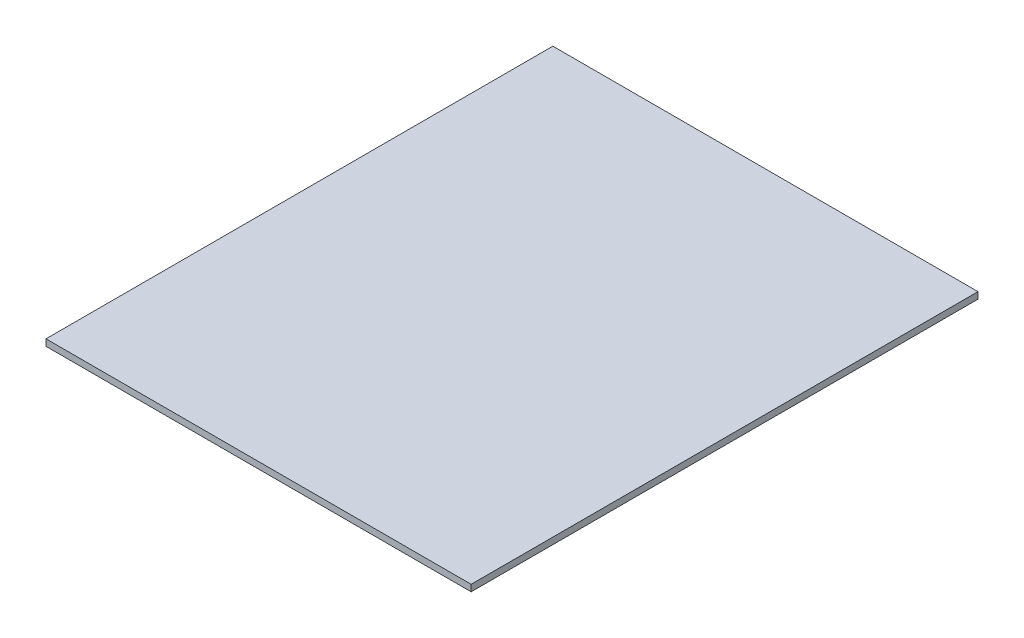
from build123d import *

# Parameters (mm, degrees)
SKETCH1_W           = 650
SKETCH1_H           = 774.95
BOSS_EXTRUDE1_DEPTH = 10
SKETCH2_R           = 3
BOSS_EXTRUDE2_DEPTH = 10


with BuildPart() as part:
    # Sketch1 → Boss-Extrude1 (new body)
    with BuildSketch(Plane(origin=(0, 0, 0), x_dir=(1, 0, 0), z_dir=(0, 1, 0))):
        Rectangle(SKETCH1_W, SKETCH1_H)
    extrude(amount=BOSS_EXTRUDE1_DEPTH)

    # Sketch2 → Boss-Extrude2 (add)
    with BuildSketch(Plane.XZ):
        with Locations(Location((-203.532027454, 369.975, 0), (0, 0, 270))):
            Circle(SKETCH2_R)
        with Locations(Location((196.467972546, 369.975, 0), (0, 0, 270))):
            Circle(SKETCH2_R)
    boss_extrude2 = extrude(amount=BOSS_EXTRUDE2_DEPTH)

    # Mirror1: Boss-Extrude2 across plane
    add(boss_extrude2.mirror(Plane.XY))


solid = part.part
